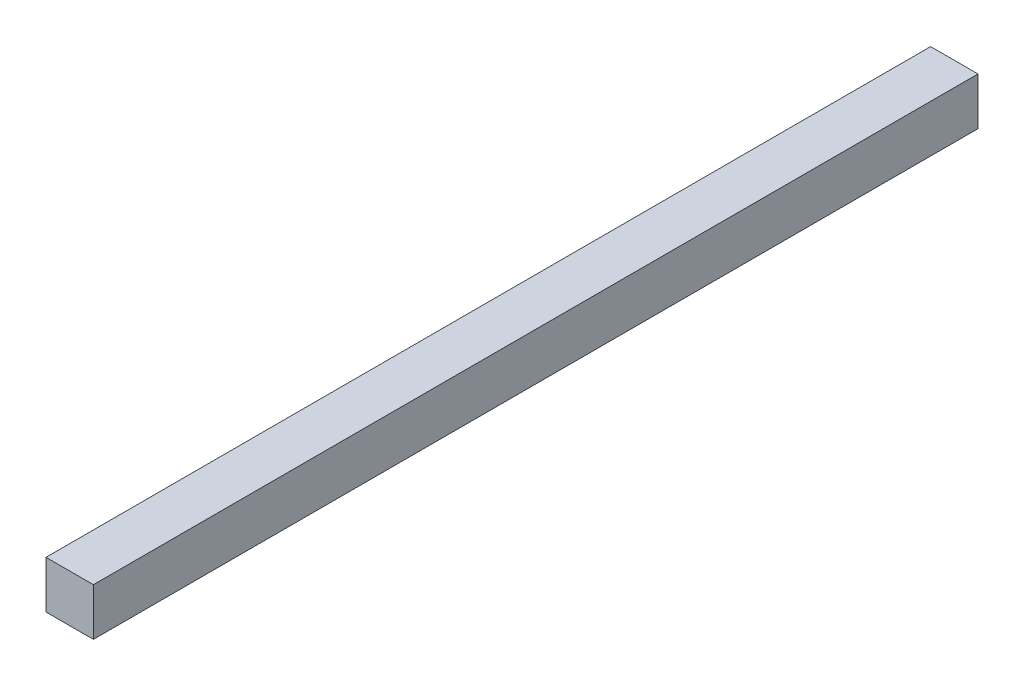
from build123d import *

# Parameters (mm, degrees)
SKETCH1_W           = 30
SKETCH1_H           = 30
BOSS_EXTRUDE1_DEPTH = 560


with BuildPart() as part:
    # Sketch1 → Boss-Extrude1 (new body)
    with BuildSketch(Plane.XY):
        Rectangle(SKETCH1_W, SKETCH1_H)
    extrude(amount=BOSS_EXTRUDE1_DEPTH)


solid = part.part
